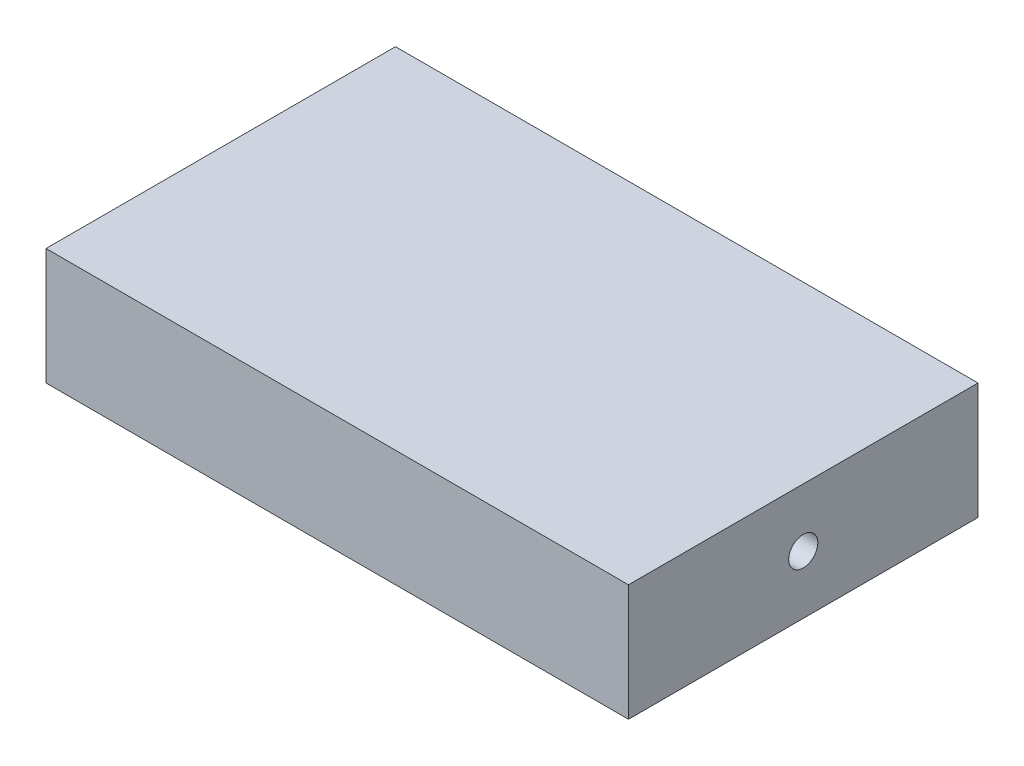
from build123d import *

# Parameters (mm, degrees)
SKETCH1_W                    = 63.5
SKETCH1_H                    = 38.1
BOSS_EXTRUDE1_DEPTH          = 12.7
F_1_8_0_125_DIAMETER_HOLE1_D = 3.175


with BuildPart() as part:
    # Sketch1 → Boss-Extrude1 (new body)
    with BuildSketch(Plane(origin=(0, 0, 0), x_dir=(1, 0, 0), z_dir=(0, 1, 0))):
        Rectangle(SKETCH1_W, SKETCH1_H)
    extrude(amount=BOSS_EXTRUDE1_DEPTH)

    # 1/8 (0.125) Diameter Hole1 (through all)
    with Locations(Plane.ZY.offset(31.75)):
        with Locations((0, 6.35)):
            Hole(F_1_8_0_125_DIAMETER_HOLE1_D / 2)


solid = part.part
